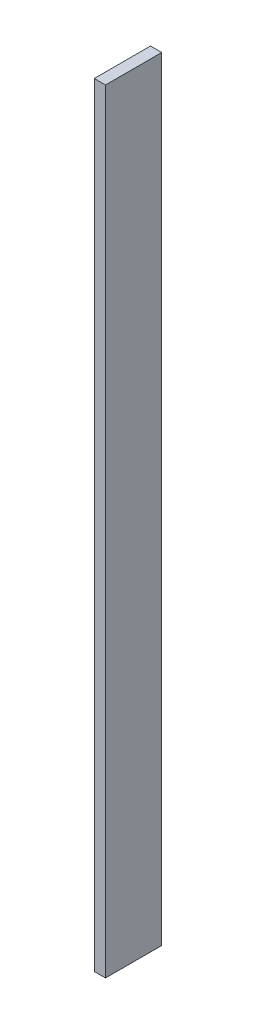
from build123d import *

# Parameters (mm, degrees)
SKETCH1_W           = 10.16
SKETCH1_H           = 50.8
BOSS_EXTRUDE1_DEPTH = 698.5


with BuildPart() as part:
    # Sketch1 → Boss-Extrude1 (new body)
    with BuildSketch(Plane(origin=(0, 0, 0), x_dir=(1, 0, 0), z_dir=(0, 1, 0))):
        with Locations((-4.891463918, 0.295993891)):
            Rectangle(SKETCH1_W, SKETCH1_H)
    extrude(amount=BOSS_EXTRUDE1_DEPTH)


solid = part.part
